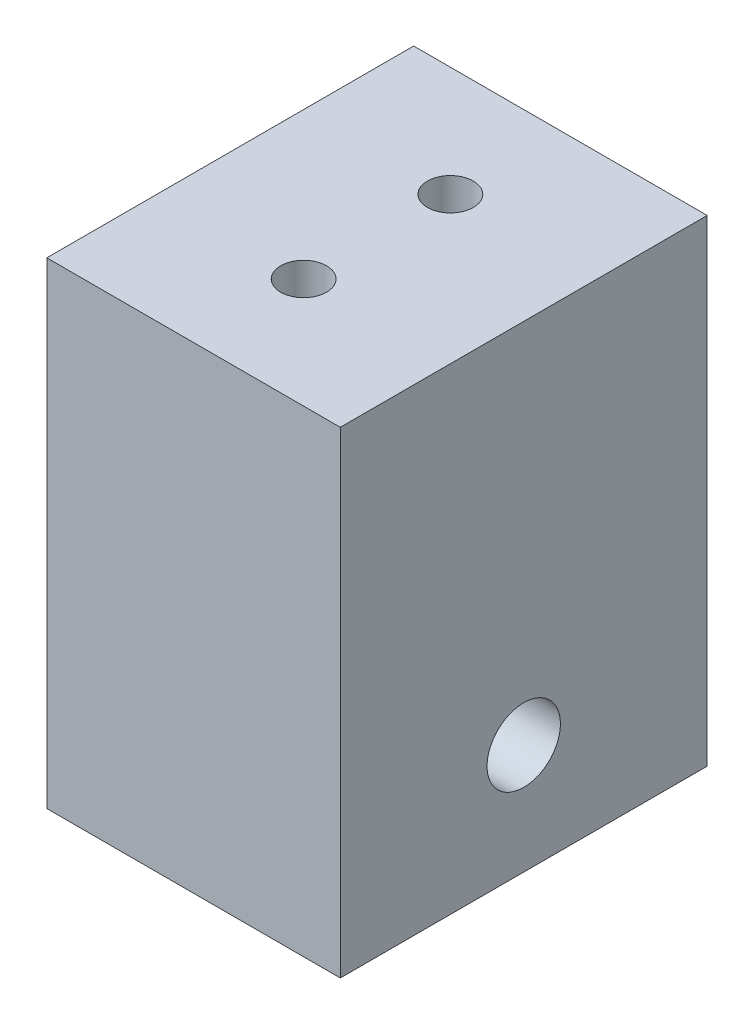
from build123d import *

# Parameters (mm, degrees)
SKETCH1_W                      = 25.4
SKETCH1_H                      = 31.75
BOSS_EXTRUDE1_DEPTH            = 41.275
SKETCH2_R                      = 3.175
F_1_4_THROUGH_HOLE_DEPTH       = 51.998051433
SKETCH3_R                      = 1.984375
F_10_32_THREADED_HOLES_1_DEPTH = 25.4


with BuildPart() as part:
    # Sketch1 → Boss-Extrude1 (new body)
    with BuildSketch(Plane(origin=(0, 0, 0), x_dir=(1, 0, 0), z_dir=(0, 1, 0))):
        Rectangle(SKETCH1_W, SKETCH1_H)
    extrude(amount=BOSS_EXTRUDE1_DEPTH)

    # Sketch2 → 1/4" Through Hole (cut, through all)
    with BuildSketch(Plane(origin=(12.7, 0, 0), x_dir=(0, 0, -1), z_dir=(1, 0, 0))):
        with Locations((0, 9.525)):
            Circle(SKETCH2_R)
    extrude(amount=-F_1_4_THROUGH_HOLE_DEPTH, mode=Mode.SUBTRACT)

    # Sketch3 → 10-32 Threaded Holes (1") (cut)
    with BuildSketch(Plane(origin=(0, 41.275, 0), x_dir=(1, 0, 0), z_dir=(0, 1, 0))):
        with Locations(Location((0, 6.35, 0), (0, 0, 270))):
            Circle(SKETCH3_R)
        with Locations(Location((0, -6.35, 0), (0, 0, 270))):
            Circle(SKETCH3_R)
    extrude(amount=-F_10_32_THREADED_HOLES_1_DEPTH, mode=Mode.SUBTRACT)


solid = part.part
